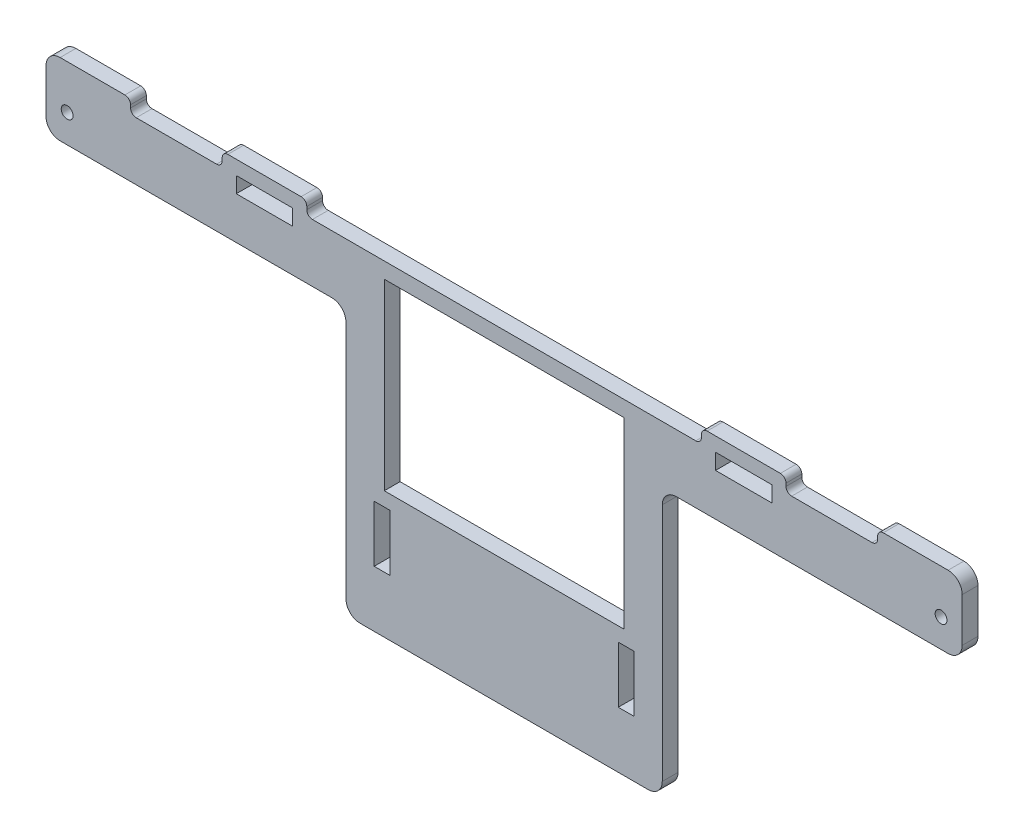
from build123d import *

# Parameters (mm, degrees)
SKETCH_1_W               = 325
SKETCH_1_H               = 110
SKETCH_1_R               = 2.1
EXTRUDE_1_DEPTH          = 5.6
EXTRUDE_2_DEPTH          = 5.6
SKETCH_2_W               = 85
SKETCH_2_H               = 65
SKETCH_2_W_2             = 5.6
SKETCH_2_H_2             = 20
SKETCH_2_W_3             = 20
SKETCH_2_H_3             = 5.6
CUT_EXTRUDE_1_DEPTH      = 176.331029769
SKETCH_4_W               = 106.4
SKETCH_4_H               = 95
SKETCH_4_R               = 2.1
CUT_EXTRUDE_2_DEPTH      = 176.331029769
CUT_EXTRUDE_3_DEPTH      = 176.331029769
CUT_EXTRUDE_3_DEPTH_BACK = 176.331029769
SKETCH_5_W               = 140
SKETCH_5_H               = 5
SKETCH_5_W_2             = 32.5
FILLET_1_R               = 5
FILLET_2_R               = 2


with BuildPart() as part:
    # ｽｹｯﾁ1 → ﾎﾞｽ - 押し出し1 (new body)
    with BuildSketch(Plane.XY):
        Rectangle(SKETCH_1_W, SKETCH_1_H)
        with Locations((155, 50)):
            Circle(SKETCH_1_R, mode=Mode.SUBTRACT)
        with Locations(Location((155, -50, 0), (0, 0, 180))):
            Circle(SKETCH_1_R, mode=Mode.SUBTRACT)
        with Locations(Location((-155, 50, 0), (0, 0, 180))):
            Circle(SKETCH_1_R, mode=Mode.SUBTRACT)
        with Locations((-155, -50)):
            Circle(SKETCH_1_R, mode=Mode.SUBTRACT)
    extrude(amount=EXTRUDE_1_DEPTH)

    # ｽｹｯﾁ3 → ﾎﾞｽ - 押し出し2 (add)
    with BuildSketch(Plane.XY.offset(5.6)):
        Polygon((-162.5, 65.6), (-162.5, 55), (-95, 55), (-95, 60.6), (-75, 60.6), (-75, 55), (0, 55), (0, 65.6), align=None)
        Polygon((162.5, 65.6), (0, 65.6), (0, 55), (75, 55), (75, 60.6), (95, 60.6), (95, 55), (162.5, 55), align=None)
    extrude(amount=-EXTRUDE_2_DEPTH)

    # ｽｹｯﾁ2 → ｶｯﾄ - 押し出し1 (cut, through all)
    with BuildSketch(Plane.XY.offset(5.6)):
        with Locations((0, 22.5)):
            Rectangle(SKETCH_2_W, SKETCH_2_H)
        with Locations((-43.3, -25)):
            Rectangle(SKETCH_2_W_2, SKETCH_2_H_2)
        with Locations((43.3, -25)):
            Rectangle(SKETCH_2_W_2, SKETCH_2_H_2)
        with Locations((85, 57.8)):
            Rectangle(SKETCH_2_W_3, SKETCH_2_H_3)
        with Locations((-85, 57.8)):
            Rectangle(SKETCH_2_W_3, SKETCH_2_H_3)
    extrude(amount=-CUT_EXTRUDE_1_DEPTH, mode=Mode.SUBTRACT)

    # ｽｹｯﾁ4 → ｶｯﾄ - 押し出し2 (cut, through all)
    # profile 1 of 2: a face of its own
    with BuildSketch(Plane.XY.offset(5.6)):
        with Locations((-109.3, -7.5)):
            Rectangle(SKETCH_4_W, SKETCH_4_H)
        with Locations((-155, -50)):
            Circle(SKETCH_4_R, mode=Mode.SUBTRACT)
    # profile 2 of 2: a face of its own
    with BuildSketch(Plane.XY.offset(5.6)):
        with Locations((109.3, -7.5)):
            Rectangle(SKETCH_4_W, SKETCH_4_H)
        with Locations((155, -50)):
            Circle(SKETCH_4_R, mode=Mode.SUBTRACT)
    extrude(amount=-CUT_EXTRUDE_2_DEPTH, mode=Mode.SUBTRACT)

    # ｽｹｯﾁ5 → ｶｯﾄ - 押し出し3 (cut, two sides: drawn at the far end of the back side and taken through both)
    with BuildSketch(Plane.XY.offset(5.6).offset(-CUT_EXTRUDE_3_DEPTH_BACK)):
        with Locations((0, 63.1)):
            Rectangle(SKETCH_5_W, SKETCH_5_H)
        with Locations((-116.25, 63.1)):
            Rectangle(SKETCH_5_W_2, SKETCH_5_H)
        with Locations((116.25, 63.1)):
            Rectangle(SKETCH_5_W_2, SKETCH_5_H)
    extrude(amount=CUT_EXTRUDE_3_DEPTH + CUT_EXTRUDE_3_DEPTH_BACK, mode=Mode.SUBTRACT)

    # ﾌｨﾚｯﾄ1
    fillet_1_edges = [part.edges().sort_by_distance(p)[0] for p in [
        (-56.1, -55, 2.8),
        (-162.5, 40, 2.8),
        (-56.1, 40, 2.8),
        (162.5, 40, 2.8),
        (56.1, -55, 2.8),
        (56.1, 40, 2.8),
        (-162.5, 65.6, 2.8),
        (162.5, 65.6, 2.8),
    ]]
    fillet(fillet_1_edges, radius=FILLET_1_R)

    # ﾌｨﾚｯﾄ2
    fillet_2_edges = [part.edges().sort_by_distance(p)[0] for p in [
        (100, 65.6, 2.8),
        (132.5, 65.6, 2.8),
        (132.5, 60.6, 2.8),
        (100, 60.6, 2.8),
        (-132.5, 60.6, 2.8),
        (-132.5, 65.6, 2.8),
        (-100, 65.6, 2.8),
        (-100, 60.6, 2.8),
        (70, 65.6, 2.8),
        (70, 60.6, 2.8),
        (-70, 60.6, 2.8),
        (-70, 65.6, 2.8),
    ]]
    fillet(fillet_2_edges, radius=FILLET_2_R)


solid = part.part
